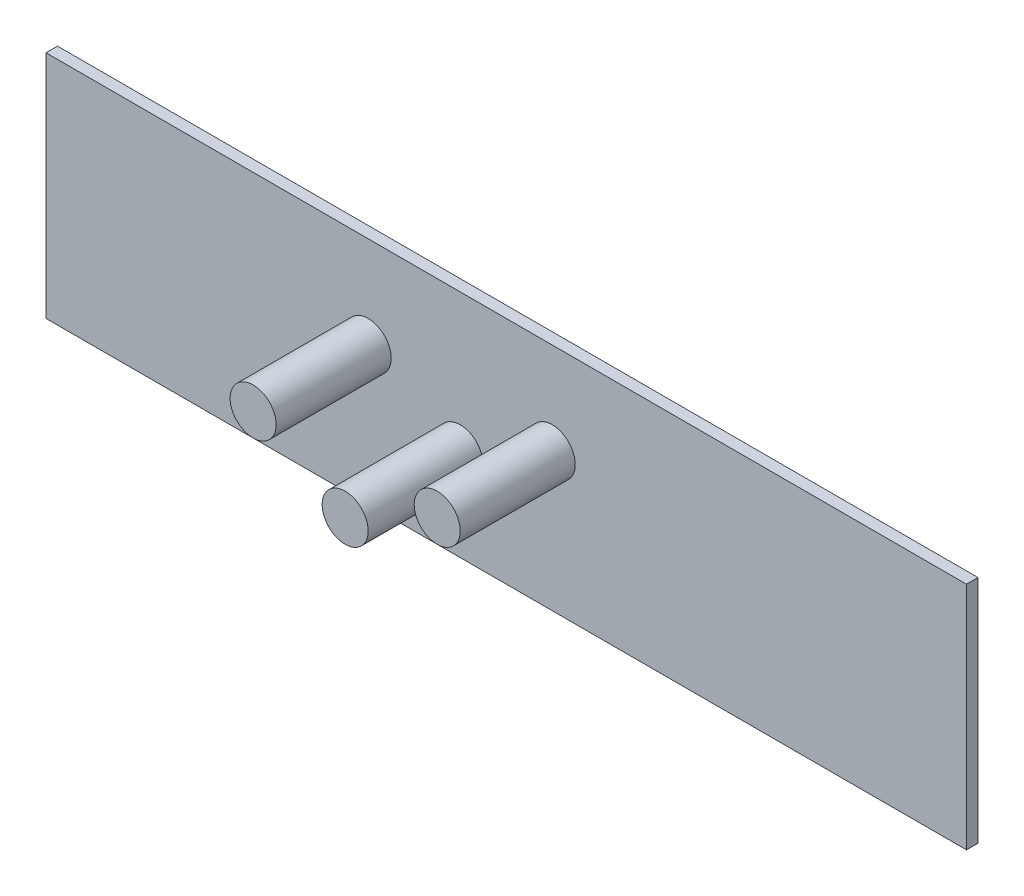
from build123d import *

# Parameters (mm, degrees)
SKETCH1_W           = 20000
SKETCH1_H           = 5000
BOSS_EXTRUDE1_DEPTH = 250
SKETCH2_R           = 500
BOSS_EXTRUDE2_DEPTH = 2500


with BuildPart() as part:
    # Sketch1 → Boss-Extrude1 (new body)
    with BuildSketch(Plane.XY):
        with Locations((-5000, 0)):
            Rectangle(SKETCH1_W, SKETCH1_H)
    extrude(amount=-BOSS_EXTRUDE1_DEPTH)

    # Sketch2 → Boss-Extrude2 (add)
    with BuildSketch(Plane.XY):
        with Locations(Location((-8000, 500, 0), (0, 0, 180))):
            Circle(SKETCH2_R)
        with Locations(Location((-6000, -500, 0), (0, 0, 180))):
            Circle(SKETCH2_R)
        with Locations(Location((-4000, 500, 0), (0, 0, 180))):
            Circle(SKETCH2_R)
    extrude(amount=BOSS_EXTRUDE2_DEPTH)


solid = part.part
